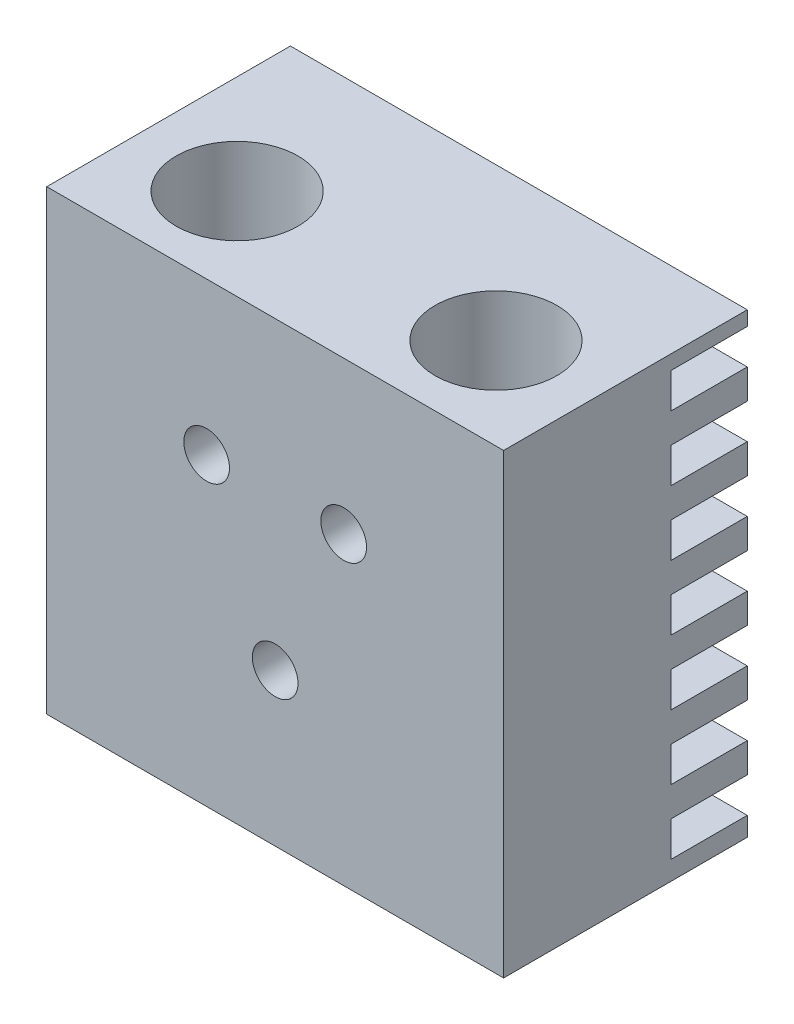
from build123d import *

# Parameters (mm, degrees)
SKETCH1_W           = 30
SKETCH1_H           = 16
BOSS_EXTRUDE1_DEPTH = 30
CUT_EXTRUDE1_REACH  = 47.343
SKETCH2_R           = 2.1
SKETCH3_R           = 4
CUT_EXTRUDE2_DEPTH  = 6.5
SKETCH4_R           = 3.5
CUT_EXTRUDE3_DEPTH  = 14
SKETCH6_W           = 6.374381548
SKETCH6_H           = 2.3
CUT_EXTRUDE8_DEPTH  = 46.343136195
SKETCH7_R           = 1.5
CUT_EXTRUDE9_DEPTH  = 8


with BuildPart() as part:
    # Sketch1 → Boss-Extrude1 (new body)
    with BuildSketch(Plane(origin=(0, 0, 0), x_dir=(1, 0, 0), z_dir=(0, 1, 0))):
        with Locations((15, 8)):
            Rectangle(SKETCH1_W, SKETCH1_H)
    extrude(amount=BOSS_EXTRUDE1_DEPTH)

    # Sketch2 → Cut-Extrude1 (cut, up to next)
    with BuildSketch(Plane(origin=(0, 30, 0), x_dir=(1, 0, 0), z_dir=(0, 1, 0)), mode=Mode.PRIVATE) as cut_extrude1_sk1:
        with Locations(Location((6.5, 6, 0), (0, 0, 270))):
            Circle(SKETCH2_R)
    cut_extrude1_tool1 = extrude(cut_extrude1_sk1.sketch, amount=-CUT_EXTRUDE1_REACH, mode=Mode.PRIVATE) & part.part
    # Sketch2 → Cut-Extrude1 (cut, up to next)
    with BuildSketch(Plane(origin=(0, 30, 0), x_dir=(1, 0, 0), z_dir=(0, 1, 0)), mode=Mode.PRIVATE) as cut_extrude1_sk2:
        with Locations(Location((23.5, 6, 0), (0, 0, 270))):
            Circle(SKETCH2_R)
    cut_extrude1_tool2 = extrude(cut_extrude1_sk2.sketch, amount=-CUT_EXTRUDE1_REACH, mode=Mode.PRIVATE) & part.part
    add(cut_extrude1_tool1.solids().sort_by_distance((6.5, 30, -6))[0], mode=Mode.SUBTRACT)
    add(cut_extrude1_tool2.solids().sort_by_distance((23.5, 30, -6))[0], mode=Mode.SUBTRACT)

    # Sketch3 → Cut-Extrude2 (cut)
    with BuildSketch(Plane(origin=(0, 30, 0), x_dir=(1, 0, 0), z_dir=(0, 1, 0))):
        with Locations(Location((6.5, 6, 0), (0, 0, 270))):
            Circle(SKETCH3_R)
        with Locations(Location((23.5, 6, 0), (0, 0, 270))):
            Circle(SKETCH3_R)
    extrude(amount=-CUT_EXTRUDE2_DEPTH, mode=Mode.SUBTRACT)

    # Sketch4 → Cut-Extrude3 (cut)
    with BuildSketch(Plane.XZ):
        with Locations(Location((6.5, -6, 0), (0, 0, 270))):
            Circle(SKETCH4_R)
        with Locations(Location((23.5, -6, 0), (0, 0, 270))):
            Circle(SKETCH4_R)
    extrude(amount=-CUT_EXTRUDE3_DEPTH, mode=Mode.SUBTRACT)

    # Sketch6 → Cut-Extrude8 (cut, through all)
    with BuildSketch(Plane(origin=(30, 0, 0), x_dir=(0, 0, -1), z_dir=(1, 0, 0))):
        with Locations((14.187190774, 2.4)):
            Rectangle(SKETCH6_W, SKETCH6_H)
        with Locations((14.187190774, 6.65)):
            Rectangle(SKETCH6_W, SKETCH6_H)
        with Locations((14.187190774, 10.9)):
            Rectangle(SKETCH6_W, SKETCH6_H)
        with Locations((14.187190774, 15.15)):
            Rectangle(SKETCH6_W, SKETCH6_H)
        with Locations((14.187190774, 19.4)):
            Rectangle(SKETCH6_W, SKETCH6_H)
        with Locations((14.187190774, 23.65)):
            Rectangle(SKETCH6_W, SKETCH6_H)
        with Locations((14.187190774, 27.9)):
            Rectangle(SKETCH6_W, SKETCH6_H)
    extrude(amount=-CUT_EXTRUDE8_DEPTH, mode=Mode.SUBTRACT)

    # Sketch7 → Cut-Extrude9 (cut)
    with BuildSketch(Plane.XY):
        with Locations((15, 10)):
            Circle(SKETCH7_R)
        with Locations((10.5, 20)):
            Circle(SKETCH7_R)
        with Locations((19.5, 20)):
            Circle(SKETCH7_R)
    extrude(amount=-CUT_EXTRUDE9_DEPTH, mode=Mode.SUBTRACT)


solid = part.part
